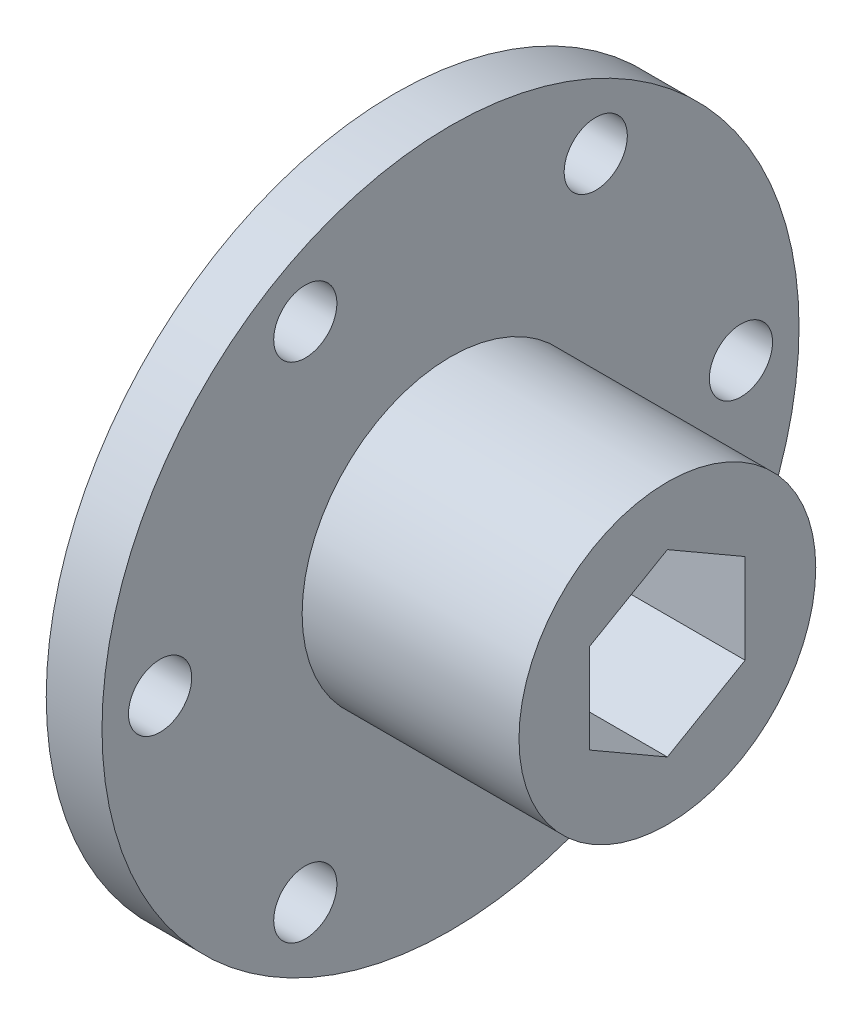
from build123d import *

# Parameters (mm, degrees)
SKETCH1_W           = 4.572
SKETCH1_H           = 28.575
SKETCH2_R           = 12.1666
BOSS_EXTRUDE1_DEPTH = 17.78
CUT_EXTRUDE1_DEPTH  = 47.180874331
HOLE1_D             = 5.1816
HOLE1_DEPTH         = 22.352


with BuildPart() as part:
    # Sketch1 → Revolve1 (revolve)
    with BuildSketch(Plane.XY, mode=Mode.PRIVATE) as revolve1_sk:
        with Locations((-15.321066246, 14.2875)):
            Rectangle(SKETCH1_W, SKETCH1_H)
    revolve(revolve1_sk.sketch.rotate(Axis((-17.607066246, 0, 0), (1, 0, 0)), 270), axis=Axis((-17.607066246, 0, 0), (1, 0, 0)))

    # Sketch2 → Boss-Extrude1 (add)
    with BuildSketch(Plane(origin=(-13.035066246, 0, 0), x_dir=(0, 0, -1), z_dir=(1, 0, 0))):
        Circle(SKETCH2_R)
    extrude(amount=BOSS_EXTRUDE1_DEPTH)

    # Sketch3 → Cut-Extrude1 (cut, through all)
    with BuildSketch(Plane.ZY.offset(17.607066246)):
        Polygon((0, -7.361697812), (6.3754, -3.680858906), (6.3754, 3.680818906), (0, 7.361657812), (-6.3754, 3.680818906), (-6.3754, -3.680858906), align=None)
    extrude(amount=-CUT_EXTRUDE1_DEPTH, mode=Mode.SUBTRACT)

    # Hole1
    with Locations(Plane.ZY.offset(17.607066246)):
        with Locations((11.90625, -20.622229928), (-11.90625, -20.622229928), (-23.8125, 0), (-11.90625, 20.622229928), (11.90625, 20.622229928), (23.8125, 0)):
            Hole(HOLE1_D / 2, depth=HOLE1_DEPTH)


solid = part.part
